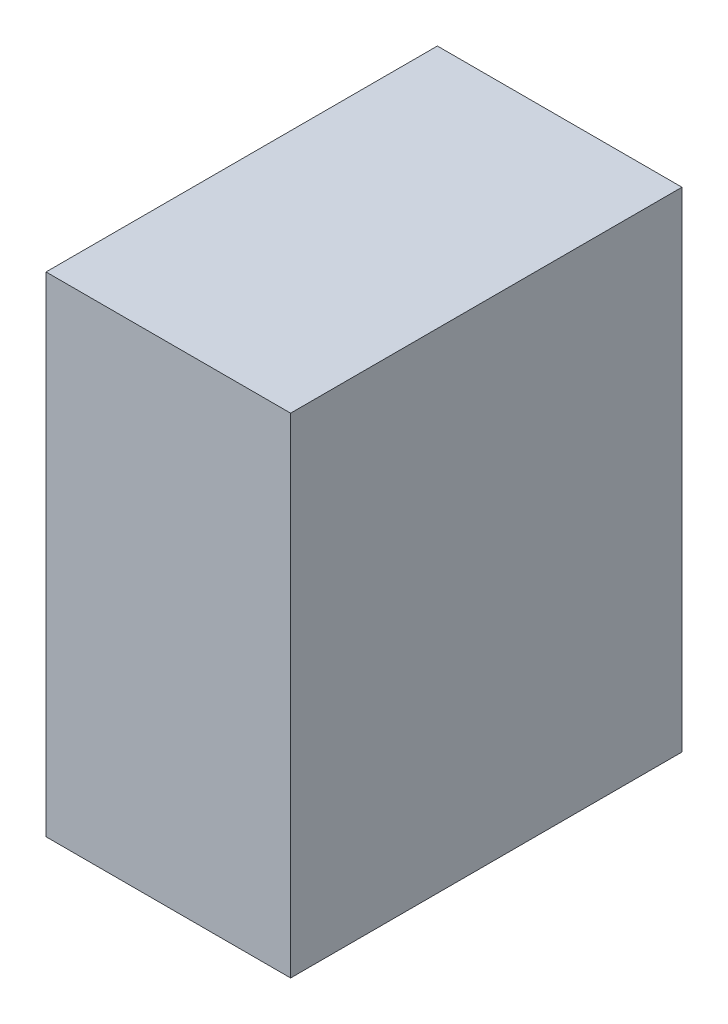
from build123d import *

# Parameters (mm, degrees)
SKETCH1_W           = 0.25
SKETCH1_H           = 0.5
BOSS_EXTRUDE1_DEPTH = 0.4


with BuildPart() as part:
    # Sketch1 → Boss-Extrude1 (new body)
    with BuildSketch(Plane.XY):
        with Locations((0.125, 0.25)):
            Rectangle(SKETCH1_W, SKETCH1_H)
    extrude(amount=BOSS_EXTRUDE1_DEPTH)


solid = part.part
